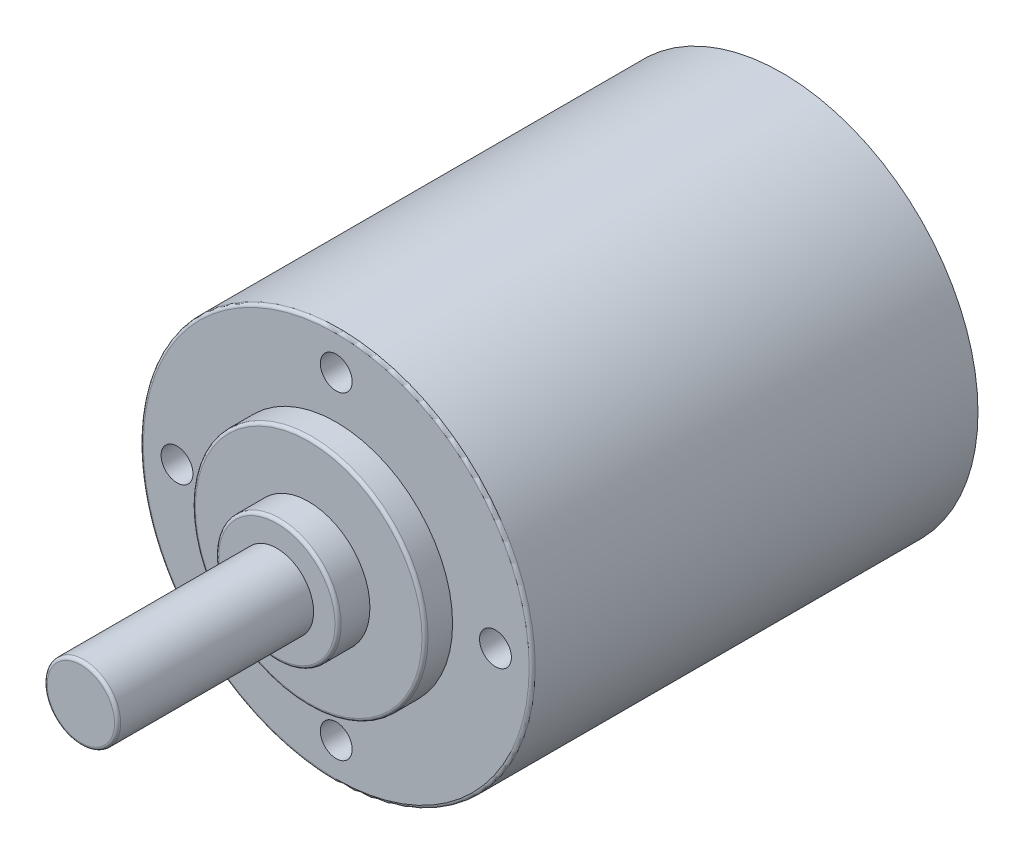
from build123d import *

# Parameters (mm, degrees)
ESQUISSE1_R             = 16
BOSS_EXTRU_1_DEPTH      = 36.4
ESQUISSE2_R             = 9.5
BOSS_EXTRU_2_DEPTH      = 2.25
ESQUISSE3_R             = 5
BOSS_EXTRU_3_DEPTH      = 2.6
ESQUISSE4_R             = 3
BOSS_EXTRU_4_DEPTH      = 16
CONG_1_R                = 0.25
ESQUISSE6_R             = 1.3
ENL_V_MAT_EXTRU_1_DEPTH = 7
ESQUISSE7_R             = 2
ENL_V_MAT_EXTRU_2_DEPTH = 13.8


with BuildPart() as part:
    # Esquisse1 → Boss.-Extru.1 (new body)
    with BuildSketch(Plane.XY):
        Circle(ESQUISSE1_R)
    extrude(amount=BOSS_EXTRU_1_DEPTH)

    # Esquisse2 → Boss.-Extru.2 (add)
    with BuildSketch(Plane.XY.offset(36.4)):
        Circle(ESQUISSE2_R)
    extrude(amount=BOSS_EXTRU_2_DEPTH)

    # Esquisse3 → Boss.-Extru.3 (add)
    with BuildSketch(Plane.XY.offset(38.65)):
        Circle(ESQUISSE3_R)
    extrude(amount=BOSS_EXTRU_3_DEPTH)

    # Esquisse4 → Boss.-Extru.4 (add)
    with BuildSketch(Plane.XY.offset(41.25)):
        Circle(ESQUISSE4_R)
    extrude(amount=BOSS_EXTRU_4_DEPTH)

    # Congé1
    cong_1_edges = [part.edges().sort_by_distance(p)[0] for p in [
        (-5, 0, 41.25),
        (-3, 0, 57.25),
        (-16, 0, 36.4),
        (-9.5, 0, 38.65),
    ]]
    fillet(cong_1_edges, radius=CONG_1_R)

    # Esquisse6 → Enlèv. mat.-Extru.1 (cut)
    with BuildSketch(Plane.XY.offset(36.4)):
        with Locations((0, 13)):
            Circle(ESQUISSE6_R)
        with Locations((-13, 0)):
            Circle(ESQUISSE6_R)
        with Locations((13, 0)):
            Circle(ESQUISSE6_R)
        with Locations((0, -13)):
            Circle(ESQUISSE6_R)
    extrude(amount=-ENL_V_MAT_EXTRU_1_DEPTH, mode=Mode.SUBTRACT)

    # Esquisse7 → Enlèv. mat.-Extru.2 (cut)
    with BuildSketch(Plane(origin=(0, 0, 0), x_dir=(-1, 0, 0), z_dir=(0, 0, -1))):
        Circle(ESQUISSE7_R)
    extrude(amount=-ENL_V_MAT_EXTRU_2_DEPTH, mode=Mode.SUBTRACT)


solid = part.part
